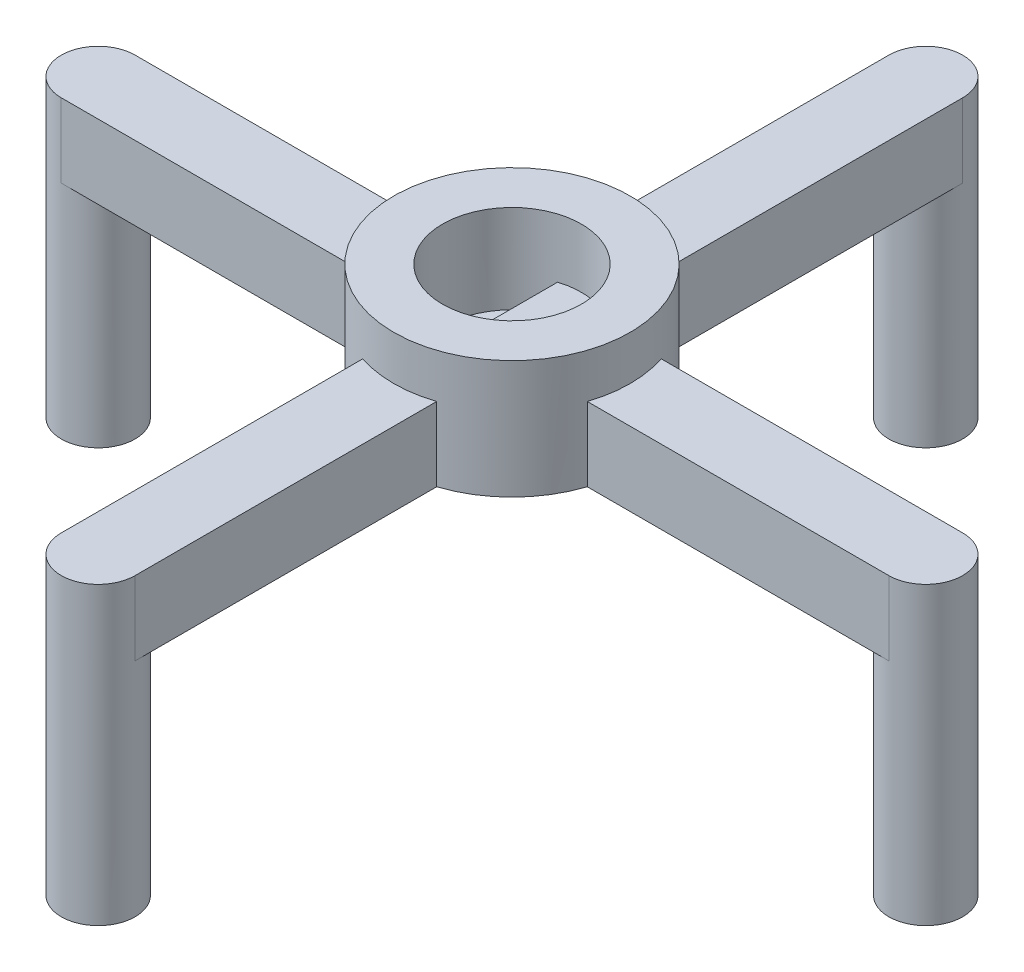
from build123d import *
from build123d.topology import SkipClean

# Parameters (mm, degrees)
SKETCH1_R                            = 0.625
BOSS_EXTRUDE1_DEPTH                  = 5
BOSS_EXTRUDE1_2_DEPTH                = 5
BOSS_EXTRUDE2_REACH                  = 11.14
BOSS_EXTRUDE2_END_RADIUS             = 0.625
SKETCH2_W                            = 1.25
SKETCH2_H                            = 1.25
BOSS_EXTRUDE2_DIRECTION_2_REACH      = 11.14
BOSS_EXTRUDE2_DIRECTION_2_END_RADIUS = 0.625
CIRPATTERN4_COUNT                    = 2
CIRPATTERN4_ANGLE                    = 90
SKETCH7_R                            = 1.5
CUT_EXTRUDE1_DEPTH                   = 1.25
SKETCH8_R                            = 2
BOSS_EXTRUDE4_DEPTH                  = 0.5
SKETCH9_R                            = 2
SKETCH9_R_2                          = 1.175
BOSS_EXTRUDE5_DEPTH                  = 1.5
BOSS_EXTRUDE6_DEPTH                  = 0.5


with BuildPart() as part:
    # Sketch1 → Boss-Extrude1 (new body)
    with BuildSketch(Plane(origin=(0, 0, 0), x_dir=(1, 0, 0), z_dir=(0, 1, 0))):
        with Locations(Location((-7, 0, 0), (0, 0, 270))):
            Circle(SKETCH1_R)
    extrude(amount=BOSS_EXTRUDE1_DEPTH)



with BuildPart() as body_2:
    # Sketch1 → Boss-Extrude1 2 (new body)
    with BuildSketch(Plane(origin=(0, 0, 0), x_dir=(1, 0, 0), z_dir=(0, 1, 0))):
        with Locations(Location((7, 0, 0), (0, 0, 270))):
            Circle(SKETCH1_R)
    extrude(amount=BOSS_EXTRUDE1_2_DEPTH)


with BuildPart() as part_1:
    add(part.part)

    add(body_2.part)  # Boss-Extrude2 merges body 2
    # Boss-Extrude2: up to this cylinder (the profile starts outside it)
    boss_extrude2_end = Plane(origin=(7, 4.375, 0), z_dir=(0, -1, 0)) * Cylinder(BOSS_EXTRUDE2_END_RADIUS, 24.53, mode=Mode.PRIVATE)
    # Sketch2 → Boss-Extrude2 (add, up to the surface)
    with BuildSketch(Plane(origin=(0, 0, 0), x_dir=(0, 0, -1), z_dir=(1, 0, 0)), mode=Mode.PRIVATE) as boss_extrude2_sk1:
        with Locations((0, 4.375)):
            Rectangle(SKETCH2_W, SKETCH2_H)
    boss_extrude2_tool1 = extrude(boss_extrude2_sk1.sketch, amount=BOSS_EXTRUDE2_REACH, mode=Mode.PRIVATE) - boss_extrude2_end
    add(boss_extrude2_tool1.solids().sort_by_distance((0, 4.375, 0))[0])

    # Boss-Extrude2 direction 2: up to this cylinder (the profile starts outside it)
    boss_extrude2_direction_2_end = Plane(origin=(-7, 4.375, 0), z_dir=(0, -1, 0)) * Cylinder(BOSS_EXTRUDE2_DIRECTION_2_END_RADIUS, 24.53, mode=Mode.PRIVATE)
    # Sketch2 → Boss-Extrude2 direction 2 (add, up to the surface)
    with BuildSketch(Plane(origin=(0, 0, 0), x_dir=(0, 0, -1), z_dir=(1, 0, 0)), mode=Mode.PRIVATE) as boss_extrude2_direction_2_sk1:
        with Locations((0, 4.375)):
            Rectangle(SKETCH2_W, SKETCH2_H)
    boss_extrude2_direction_2_tool1 = extrude(boss_extrude2_direction_2_sk1.sketch, amount=-BOSS_EXTRUDE2_DIRECTION_2_REACH, mode=Mode.PRIVATE) - boss_extrude2_direction_2_end
    add(boss_extrude2_direction_2_tool1.solids().sort_by_distance((0, 4.375, 0))[0])


with BuildPart() as cirpattern4_1:
    # CirPattern4: pattern copy
    add(part_1.part.rotate(Axis((0, 0, 0), (0, -1, 0)), 1 * CIRPATTERN4_ANGLE / (CIRPATTERN4_COUNT - 1)))


with BuildPart() as cut_extrude1_tool:
    # Sketch7 → Cut-Extrude1 (new body)
    with BuildSketch(Plane(origin=(0, 5, 0), x_dir=(1, 0, 0), z_dir=(0, 1, 0))):
        Circle(SKETCH7_R)
    extrude(amount=-CUT_EXTRUDE1_DEPTH)


with BuildPart() as part_2:
    add(part_1.part)

    # Cut-Extrude1: cut by cut_extrude1_tool
    add(cut_extrude1_tool.part, mode=Mode.SUBTRACT)


with BuildPart() as cirpattern4_1_1:
    add(cirpattern4_1.part)

    # Cut-Extrude1: cut by cut_extrude1_tool
    add(cut_extrude1_tool.part, mode=Mode.SUBTRACT)


with BuildPart() as cut_extrude1_piece_1:
    # of the separate pieces the step leaves, piece 1, a body of its own (cut_extrude1_pieces)
    add(part_2.part.solids().sort_by_distance((1.363589014, 5, -0.625))[0])



with BuildPart() as cut_extrude1_piece_2:
    # of the separate pieces the step leaves, piece 2, a body of its own (cut_extrude1_pieces)
    add(part_2.part.solids().sort_by_distance((-7, 5, -0.625))[0])


with BuildPart() as cut_extrude1_piece_1_of_cirpattern4_1:
    # of the separate pieces the step leaves, piece 1, a body of its own (cut_extrude1_pieces_of_cirpattern4_1)
    add(cirpattern4_1_1.part.solids().sort_by_distance((-0.625, 5, 1.363589014))[0])


with BuildPart() as cut_extrude1_piece_2_of_cirpattern4_1:
    # of the separate pieces the step leaves, piece 2, a body of its own (cut_extrude1_pieces_of_cirpattern4_1)
    add(cirpattern4_1_1.part.solids().sort_by_distance((0.625, 5, -7))[0])


with BuildPart() as cut_extrude1_piece_1_1:
    add(cut_extrude1_piece_1.part)

    add(cut_extrude1_piece_2.part)  # Boss-Extrude4 merges Cut-Extrude1 piece 2

    add(cut_extrude1_piece_1_of_cirpattern4_1.part)  # Boss-Extrude4 merges Cut-Extrude1 piece 1 of CirPattern4_1

    add(cut_extrude1_piece_2_of_cirpattern4_1.part)  # Boss-Extrude4 merges Cut-Extrude1 piece 2 of CirPattern4_1
    # Sketch8 → Boss-Extrude4 (add)
    with BuildSketch(Plane.XZ.offset(-3.75)):
        Circle(SKETCH8_R)
    extrude(amount=-BOSS_EXTRUDE4_DEPTH)

    # Sketch9 → Boss-Extrude5 (add)
    with SkipClean():  # the faces are left unmerged after this step: merging them gives an invalid solid
        with BuildSketch(Plane(origin=(0, 4.25, 0), x_dir=(1, 0, 0), z_dir=(0, 1, 0))):
            with Locations(Location((0, 0, 0), (0, 0, 108.209956864))):
                Circle(SKETCH9_R)
            with Locations(Location((0, 0, 0), (0, 0, 270))):
                Circle(SKETCH9_R_2, mode=Mode.SUBTRACT)
        extrude(amount=BOSS_EXTRUDE5_DEPTH)

    # Sketch11 → Boss-Extrude6 (add)
    with SkipClean():  # the faces are left unmerged after this step: merging them gives an invalid solid
        with BuildSketch(Plane(origin=(0, 4.25, 0), x_dir=(1, 0, 0), z_dir=(0, 1, 0))):
            with BuildLine():
                Line((-0.35, 0), (-0.35, 1.121661714))
                ThreePointArc((-0.35, 1.121661714), (0, 1.175), (0.35, 1.121661714))
                Line((0.35, 1.121661714), (0.35, -1.121661714))
                ThreePointArc((0.35, -1.121661714), (0, -1.175), (-0.35, -1.121661714))
                Line((-0.35, -1.121661714), (-0.35, 0))
            make_face()
        extrude(amount=BOSS_EXTRUDE6_DEPTH)


solid = cut_extrude1_piece_1_1.part
